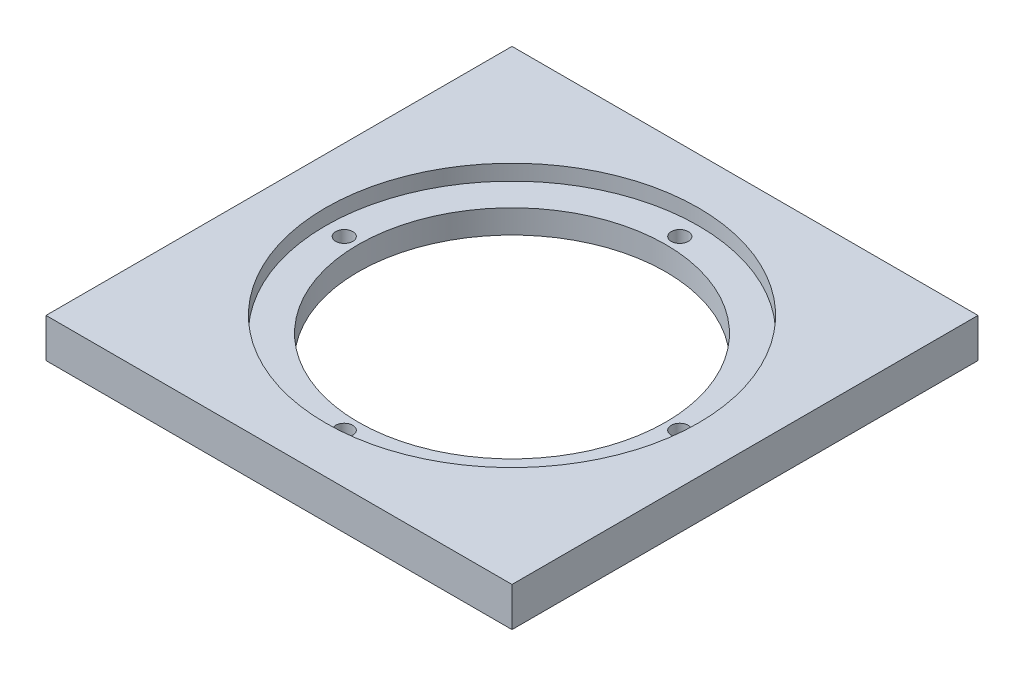
from build123d import *

# Parameters (mm, degrees)
SKETCH1_W               = 150
SKETCH1_H               = 150
SKETCH1_R               = 49.5
BOSS_EXTRUDE1_DEPTH     = 12.5984
SKETCH2_R               = 60
CUT_EXTRUDE1_DEPTH      = 5
CUT_EXTRUDE2_DEPTH      = 107.81160837
CUT_EXTRUDE2_DEPTH_BACK = 107.81160837
SKETCH3_R               = 2.75


with BuildPart() as part:
    # Sketch1 → Boss-Extrude1 (new body)
    with BuildSketch(Plane(origin=(0, 0, 0), x_dir=(1, 0, 0), z_dir=(0, 1, 0))):
        Rectangle(SKETCH1_W, SKETCH1_H)
        with Locations(Location((0, 0, 0), (0, 0, 270))):
            Circle(SKETCH1_R, mode=Mode.SUBTRACT)
    extrude(amount=-BOSS_EXTRUDE1_DEPTH)

    # Sketch2 → Cut-Extrude1 (cut)
    with BuildSketch(Plane(origin=(0, 0, 0), x_dir=(1, 0, 0), z_dir=(0, 1, 0))):
        with Locations(Location((0, 0, 0), (0, 0, 270))):
            Circle(SKETCH2_R)
    extrude(amount=-CUT_EXTRUDE1_DEPTH, mode=Mode.SUBTRACT)

    # Sketch3 → Cut-Extrude2 (cut, two sides: drawn at the far end of the back side and taken through both)
    with BuildSketch(Plane(origin=(0, 0, 0), x_dir=(1, 0, 0), z_dir=(0, 1, 0)).offset(-CUT_EXTRUDE2_DEPTH_BACK)):
        with Locations(Location((-54, 0, 0), (0, 0, 270))):
            Circle(SKETCH3_R)
        with Locations(Location((0, 54, 0), (0, 0, 270))):
            Circle(SKETCH3_R)
        with Locations(Location((54, 0, 0), (0, 0, 270))):
            Circle(SKETCH3_R)
        with Locations(Location((0, -54, 0), (0, 0, 270))):
            Circle(SKETCH3_R)
    extrude(amount=CUT_EXTRUDE2_DEPTH + CUT_EXTRUDE2_DEPTH_BACK, mode=Mode.SUBTRACT)


solid = part.part
